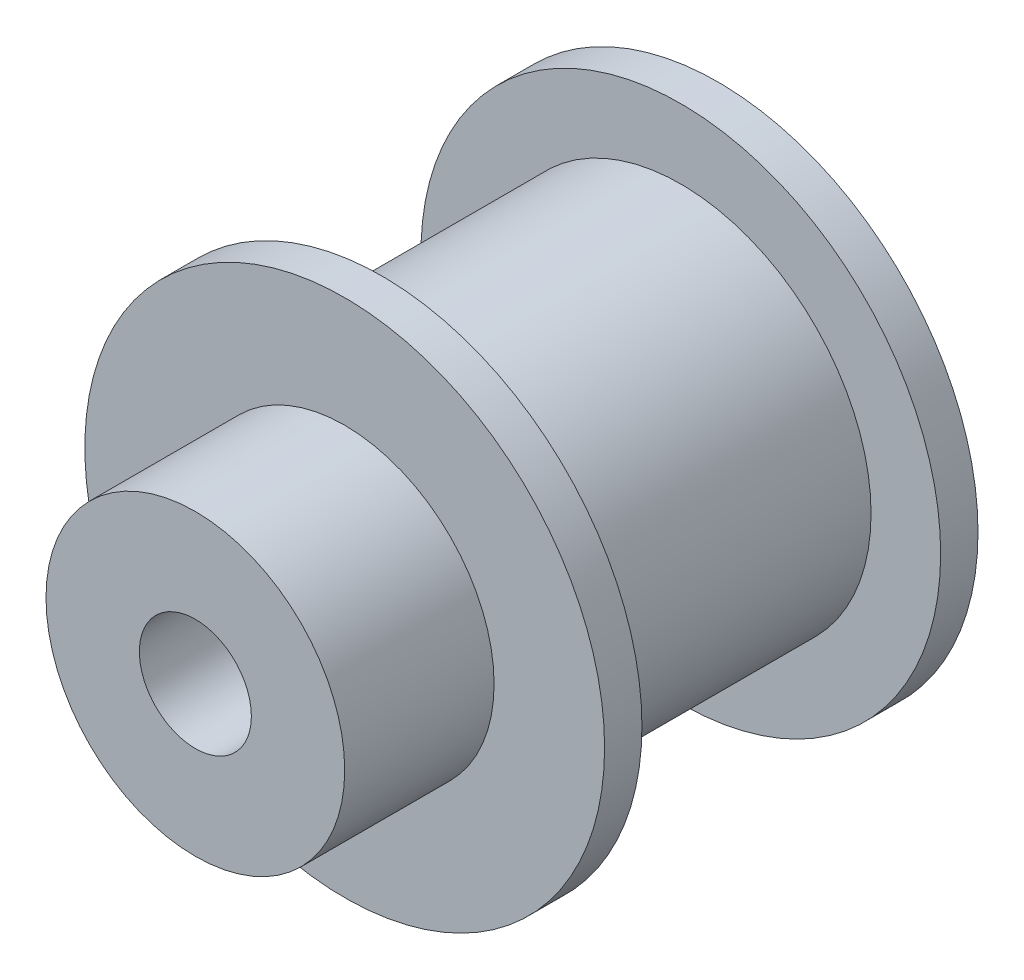
from build123d import *

# Parameters (mm, degrees)
SKETCH1_R           = 11.049
BOSS_EXTRUDE1_DEPTH = 1.5875
SKETCH2_R           = 8.0899
BOSS_EXTRUDE2_DEPTH = 12.7
SKETCH3_R           = 11.049
BOSS_EXTRUDE3_DEPTH = 1.5875
SKETCH4_R           = 6.35
BOSS_EXTRUDE4_DEPTH = 6.35
SKETCH5_R           = 2.38125
CUT_EXTRUDE1_DEPTH  = 25.4


with BuildPart() as part:
    # Sketch1 → Boss-Extrude1 (new body)
    with BuildSketch(Plane.XY):
        Circle(SKETCH1_R)
    extrude(amount=BOSS_EXTRUDE1_DEPTH)

    # Sketch2 → Boss-Extrude2 (add)
    with BuildSketch(Plane.XY.offset(1.5875)):
        Circle(SKETCH2_R)
    extrude(amount=BOSS_EXTRUDE2_DEPTH)

    # Sketch3 → Boss-Extrude3 (add)
    with BuildSketch(Plane.XY.offset(14.2875)):
        Circle(SKETCH3_R)
    extrude(amount=BOSS_EXTRUDE3_DEPTH)

    # Sketch4 → Boss-Extrude4 (add)
    with BuildSketch(Plane.XY.offset(15.875)):
        Circle(SKETCH4_R)
    extrude(amount=BOSS_EXTRUDE4_DEPTH)

    # Sketch5 → Cut-Extrude1 (cut)
    with BuildSketch(Plane.XY.offset(22.225)):
        Circle(SKETCH5_R)
    extrude(amount=-CUT_EXTRUDE1_DEPTH, mode=Mode.SUBTRACT)


solid = part.part
